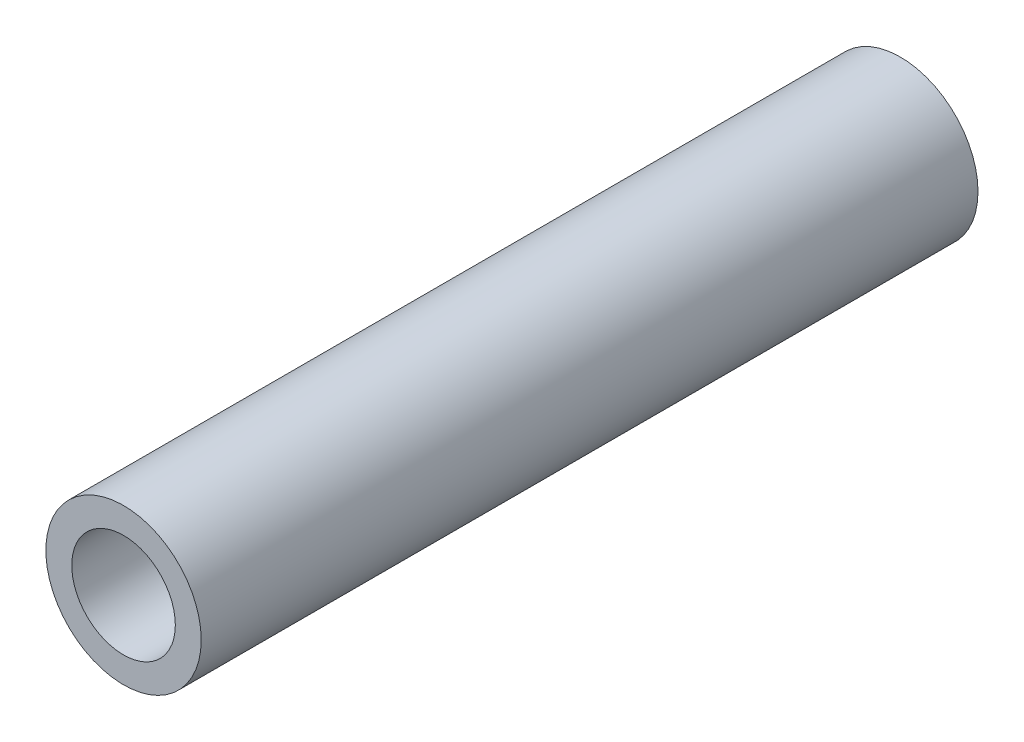
from build123d import *

# Parameters (mm, degrees)
SKETCH1_R           = 3
SKETCH1_R_2         = 2
BOSS_EXTRUDE1_DEPTH = 30


with BuildPart() as part:
    # Sketch1 → Boss-Extrude1 (new body)
    with BuildSketch(Plane.XY):
        Circle(SKETCH1_R)
        Circle(SKETCH1_R_2, mode=Mode.SUBTRACT)
    extrude(amount=BOSS_EXTRUDE1_DEPTH)


solid = part.part
